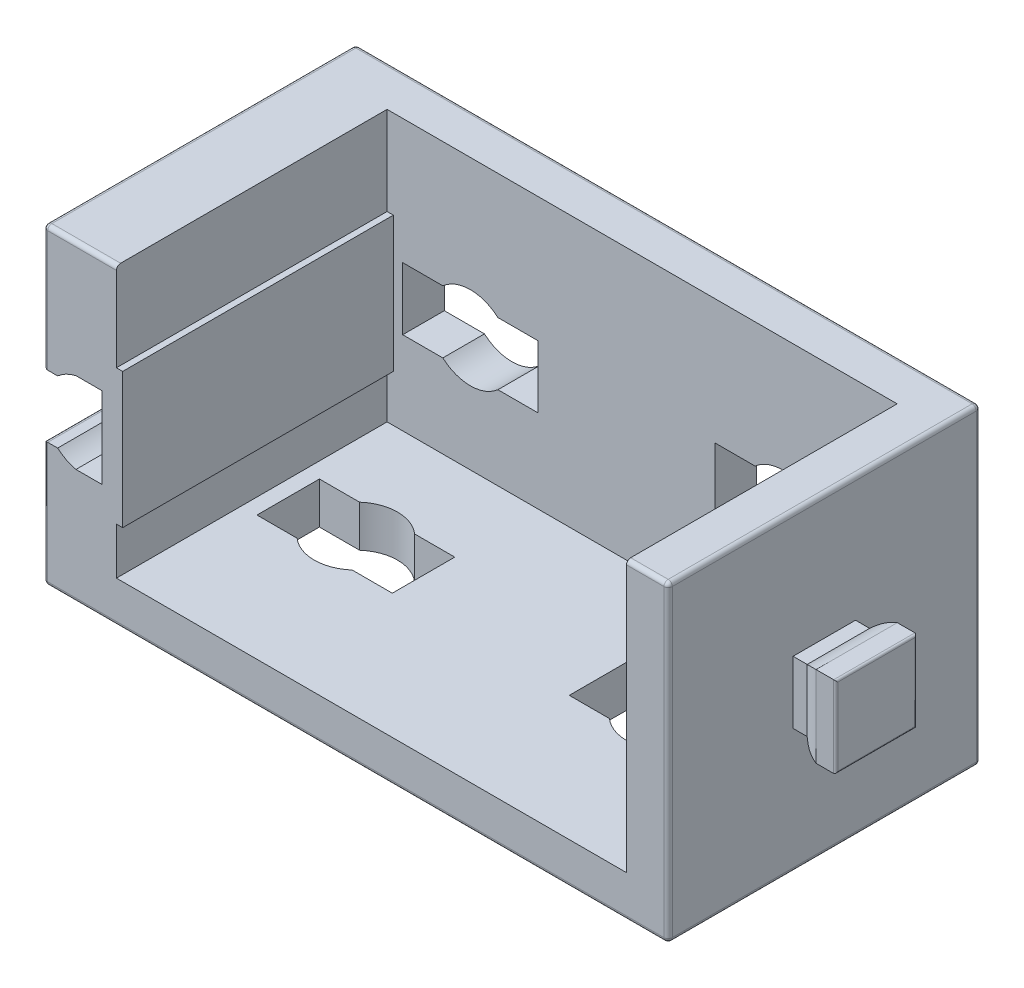
from build123d import *

# Parameters (mm, degrees)
EXTRUDE_1_DEPTH      = 7.5
EXTRUDE_1_DEPTH_BACK = 7.5
SKETCH_1_W           = 30
SKETCH_1_H           = 15
SKETCH_2_W           = 24.5
SKETCH_2_H           = 13
CUT_EXTRUDE_1_DEPTH  = 13
SKETCH_3_W           = 3
SKETCH_3_H           = 3
EXTRUDE_2_DEPTH      = 1
EXTRUDE_3_DEPTH      = 4
EXTRUDE_3_DEPTH_BACK = 1
CUT_EXTRUDE_START    = -3.9
CUT_EXTRUDE_2_DEPTH  = 3.9
CUT_EXTRUDE_3_DEPTH  = 9.45
CUT_EXTRUDE_4_DEPTH  = 2
EXTRUDE_4_REACH      = 29.5
SKETCH_8_W           = 0.3
SKETCH_8_H           = 6.5
CUT_EXTRUDE_5_DEPTH  = 2
FILLET_1_R           = 0.1
FILLET_2_R           = 0.2


with BuildPart() as part:
    # 草图1 → 凸台-拉伸1 (new, two sides: drawn at the far end of the back side and taken through both)
    with BuildSketch(Plane.XY.offset(-EXTRUDE_1_DEPTH_BACK)):
        with Locations((0, 7.5)):
            Rectangle(SKETCH_1_W, SKETCH_1_H)
    extrude(amount=EXTRUDE_1_DEPTH + EXTRUDE_1_DEPTH_BACK)

    # 草图2 → 切除-拉伸1 (cut)
    with BuildSketch(Plane.XY.offset(7.5)):
        with Locations((0.75, 8.5)):
            Rectangle(SKETCH_2_W, SKETCH_2_H)
    extrude(amount=-CUT_EXTRUDE_1_DEPTH, mode=Mode.SUBTRACT)

    # 草图3 → 凸台-拉伸2 (add)
    with BuildSketch(Plane(origin=(15, 0, 0), x_dir=(0, 0, -1), z_dir=(1, 0, 0))):
        with Locations((0, 7.5)):
            Rectangle(SKETCH_3_W, SKETCH_3_H)
    extrude(amount=EXTRUDE_2_DEPTH)

    # 草图6 → 切除-拉伸3 (cut)
    with BuildSketch(Plane.XY.offset(7.5)):
        with BuildLine():
            Line((-15, 9), (-14.322875656, 9))
            ThreePointArc((-14.322875656, 9), (-13.911838473, 9.280042303), (-13.444409721, 9.45))
            Line((-13.444409721, 9.45), (-12.2, 9.45))
            Line((-12.2, 9.45), (-12.2, 5.55))
            Line((-12.2, 5.55), (-13.444409721, 5.55))
            ThreePointArc((-13.444409721, 5.55), (-13.911838473, 5.719957697), (-14.322875656, 6))
            Line((-14.322875656, 6), (-15, 6))
            Line((-15, 6), (-15, 9))
        make_face()
    extrude(amount=-CUT_EXTRUDE_3_DEPTH, mode=Mode.SUBTRACT)

    # 草图7 → 切除-拉伸4 (cut)
    with BuildSketch(Plane.XY.offset(-5.5)):
        with BuildLine():
            Line((-6.177124344, 9), (-4.25, 9))
            Line((-4.25, 9), (-4.25, 6))
            Line((-4.25, 6), (-6.177124344, 6))
            ThreePointArc((-6.177124344, 6), (-7.5, 5.5), (-8.822875656, 6))
            Line((-8.822875656, 6), (-10.75, 6))
            Line((-10.75, 6), (-10.75, 9))
            Line((-10.75, 9), (-8.822875656, 9))
            ThreePointArc((-8.822875656, 9), (-7.5, 9.5), (-6.177124344, 9))
        make_face()
        with BuildLine():
            Line((4.25, 9), (6.177124344, 9))
            ThreePointArc((6.177124344, 9), (7.5, 9.5), (8.822875656, 9))
            Line((8.822875656, 9), (10.75, 9))
            Line((10.75, 9), (10.75, 6))
            Line((10.75, 6), (8.822875656, 6))
            ThreePointArc((8.822875656, 6), (7.5, 5.5), (6.177124344, 6))
            Line((6.177124344, 6), (4.25, 6))
            Line((4.25, 6), (4.25, 9))
        make_face()
    extrude(amount=-CUT_EXTRUDE_4_DEPTH, mode=Mode.SUBTRACT)

    # 草图8 → 凸台-拉伸4 (add, up to next)
    with BuildSketch(Plane.XY.offset(7.5), mode=Mode.PRIVATE) as extrude_4_sk1:
        with Locations((-11.35, 7.5)):
            Rectangle(SKETCH_8_W, SKETCH_8_H)
    extrude_4_tool1 = extrude(extrude_4_sk1.sketch, amount=-EXTRUDE_4_REACH, mode=Mode.PRIVATE) - part.part
    add(extrude_4_tool1.solids().sort_by_distance((-11.35, 7.5, 7.5))[0])

    # 草图9 → 切除-拉伸5 (cut)
    with BuildSketch(Plane(origin=(0, 2, 0), x_dir=(-1, 0, 0), z_dir=(0, 1, 0))):
        with BuildLine():
            Line((6.177124344, -1.5), (4.25, -1.5))
            Line((4.25, -1.5), (4.25, 1.5))
            Line((4.25, 1.5), (6.177124344, 1.5))
            ThreePointArc((6.177124344, 1.5), (7.5, 2), (8.822875656, 1.5))
            Line((8.822875656, 1.5), (10.75, 1.5))
            Line((10.75, 1.5), (10.75, -1.5))
            Line((10.75, -1.5), (8.822875656, -1.5))
            ThreePointArc((8.822875656, -1.5), (7.5, -2), (6.177124344, -1.5))
        make_face()
        with BuildLine():
            Line((-4.25, -1.5), (-6.177124344, -1.5))
            ThreePointArc((-6.177124344, -1.5), (-7.5, -2), (-8.822875656, -1.5))
            Line((-8.822875656, -1.5), (-10.75, -1.5))
            Line((-10.75, -1.5), (-10.75, 1.5))
            Line((-10.75, 1.5), (-8.822875656, 1.5))
            ThreePointArc((-8.822875656, 1.5), (-7.5, 2), (-6.177124344, 1.5))
            Line((-6.177124344, 1.5), (-4.25, 1.5))
            Line((-4.25, 1.5), (-4.25, -1.5))
        make_face()
    extrude(amount=-CUT_EXTRUDE_5_DEPTH, mode=Mode.SUBTRACT)

    # 圆角2
    fillet_2_edges = [part.edges().sort_by_distance(p)[0] for p in [
        (15, 7.5, -7.5),
        (-15, 12, 7.5),
        (0, 0, 7.5),
        (0, 15, -7.5),
        (15, 7.5, 7.5),
        (14, 15, 7.5),
        (-13.25, 15, 7.5),
        (-15, 7.5, -7.5),
        (0, 0, -7.5),
        (-15, 15, 0),
        (15, 15, 0),
        (15, 0, 0),
        (-15, 0, 0),
        (-15, 3, 7.5),
        (-15, 7.5, -1.95),
        (-15, 6, 2.775),
        (-15, 9, 2.775),
    ]]
    fillet(fillet_2_edges, radius=FILLET_2_R)


with BuildPart() as body_2:
    # 草图4 → 凸台-拉伸3 (new, two sides: drawn at the far end of the back side and taken through both)
    with BuildSketch(Plane(origin=(0, 6, 0), x_dir=(1, 0, 0), z_dir=(0, 1, 0)).offset(-EXTRUDE_3_DEPTH_BACK)):
        with BuildLine():
            Line((17.5, -1.95), (17.5, 1.95))
            Line((17.5, 1.95), (16.555590279, 1.95))
            ThreePointArc((16.555590279, 1.95), (16.088161527, 1.780042303), (15.677124344, 1.5))
            Line((15.677124344, 1.5), (15.677124344, -1.5))
            ThreePointArc((15.677124344, -1.5), (16.088161527, -1.780042303), (16.555590279, -1.95))
            Line((16.555590279, -1.95), (17.5, -1.95))
        make_face()
    extrude(amount=EXTRUDE_3_DEPTH + EXTRUDE_3_DEPTH_BACK)

    # 草图5 → 切除-拉伸2 (cut)
    with BuildSketch(Plane.XY.offset(1.95).offset(CUT_EXTRUDE_START)):
        with BuildLine():
            Line((17.5, 9.45), (16.555590279, 9.45))
            ThreePointArc((16.555590279, 9.45), (16.088161527, 9.280042303), (15.677124344, 9))
            Line((15.677124344, 9), (15.677124344, 10))
            Line((15.677124344, 10), (17.5, 10))
            Line((17.5, 10), (17.5, 9.45))
        make_face()
        with BuildLine():
            Line((15.677124344, 5), (17.5, 5))
            Line((17.5, 5), (17.5, 5.55))
            Line((17.5, 5.55), (16.555590279, 5.55))
            ThreePointArc((16.555590279, 5.55), (16.088161527, 5.719957697), (15.677124344, 6))
            Line((15.677124344, 6), (15.677124344, 5))
        make_face()
    extrude(amount=CUT_EXTRUDE_2_DEPTH, mode=Mode.SUBTRACT)

    # 圆角1
    fillet_1_edges = [body_2.edges().sort_by_distance(p)[0] for p in [
        (17.5, 7.5, 1.95),
        (17.5, 7.5, -1.95),
        (17.5, 9.45, 0),
        (17.5, 5.55, 0),
    ]]
    fillet(fillet_1_edges, radius=FILLET_1_R)


solid = Compound([part.part, body_2.part])
